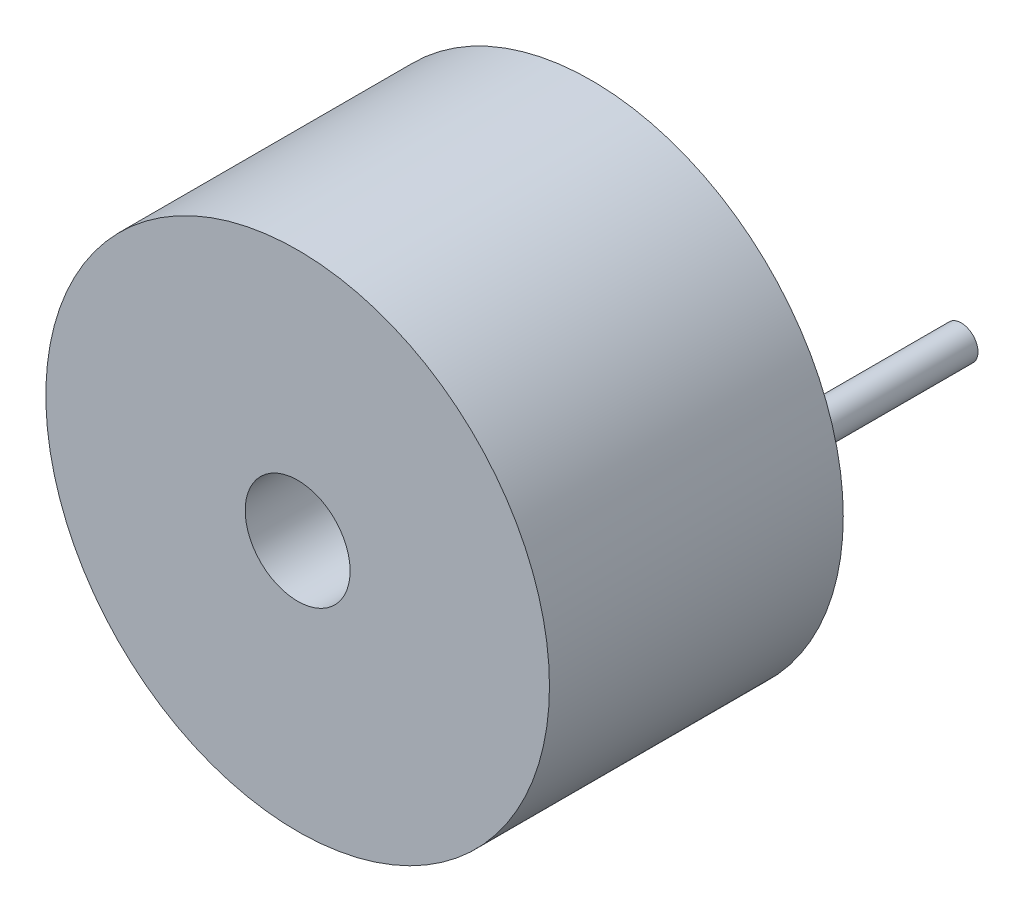
from build123d import *

# Parameters (mm, degrees)
SKETCH_1_R          = 6
EXTRUDE_1_DEPTH     = 7
SKETCH_2_R          = 0.4
EXTRUDE_2_DEPTH     = 5
SKETCH_3_R          = 1.25
CUT_EXTRUDE_1_DEPTH = 5


with BuildPart() as part:
    # 草图1 → 拉伸1 (new body)
    with BuildSketch(Plane.XY):
        Circle(SKETCH_1_R)
    extrude(amount=EXTRUDE_1_DEPTH)

    # 草图2 → 拉伸2 (add)
    with BuildSketch(Plane(origin=(0, 0, 0), x_dir=(-1, 0, 0), z_dir=(0, 0, -1))):
        with Locations(Location((-3.81, 0, 0), (0, 0, 180))):
            Circle(SKETCH_2_R)
        with Locations(Location((3.81, 0, 0), (0, 0, 180))):
            Circle(SKETCH_2_R)
    extrude(amount=EXTRUDE_2_DEPTH)

    # 草图3 → 切除-拉伸1 (cut)
    with BuildSketch(Plane.XY.offset(7)):
        Circle(SKETCH_3_R)
    extrude(amount=-CUT_EXTRUDE_1_DEPTH, mode=Mode.SUBTRACT)


solid = part.part
